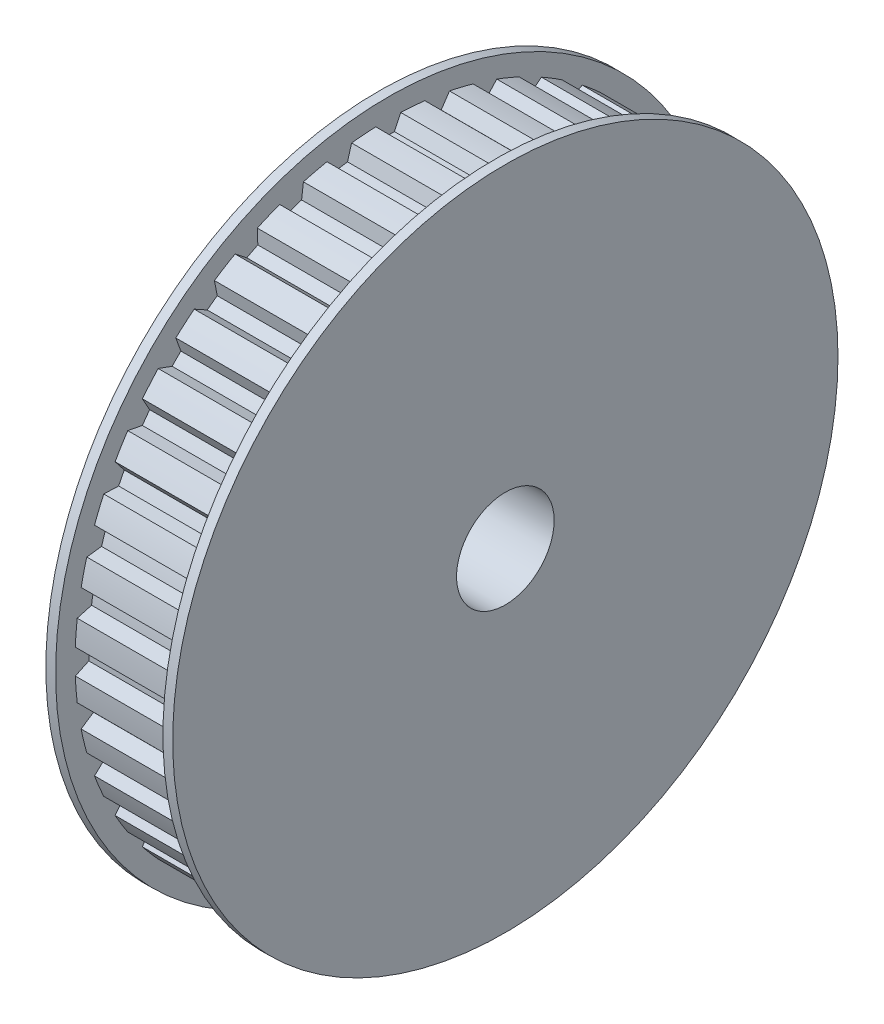
from build123d import *

# Parameters (mm, degrees)
SKETCH1_R           = 32.085
SKETCH1_R_2         = 5
BOSS_EXTRUDE1_DEPTH = 11
CUT_EXTRUDE1_DEPTH  = 47.68933979
SKETCH4_R           = 34.085
SKETCH4_R_2         = 5
BOSS_EXTRUDE2_DEPTH = 1
LPATTERN1_COUNT     = 2
LPATTERN1_PITCH     = 12


with BuildPart() as part:
    # Sketch1 → Boss-Extrude1 (new body)
    with BuildSketch(Plane(origin=(0, 0, 0), x_dir=(0, 0, -1), z_dir=(1, 0, 0))):
        Circle(SKETCH1_R)
        Circle(SKETCH1_R_2, mode=Mode.SUBTRACT)
    extrude(amount=BOSS_EXTRUDE1_DEPTH)

    # Sketch2 → Cut-Extrude1 (cut, through all)
    with BuildSketch(Plane.ZY):
        with BuildLine():
            Line((1.278957916, 32.059499242), (0.634954678, 30.678429842))
            ThreePointArc((0.634954678, 30.678429842), (0, 30.685), (-0.634954678, 30.678429842))
            Line((-0.634954678, 30.678429842), (-1.278957916, 32.059499242))
            ThreePointArc((-1.278957916, 32.059499242), (0, 32.085), (1.278957916, 32.059499242))
        make_face()
        with BuildLine():
            Line((6.278422435, 31.464720509), (5.426301093, 30.201398667))
            ThreePointArc((5.426301093, 30.201398667), (4.80019156, 30.307216731), (4.172026428, 30.400056258))
            Line((4.172026428, 30.400056258), (3.751998792, 31.864866704))
            ThreePointArc((3.751998792, 31.864866704), (5.019199811, 31.689980408), (6.278422435, 31.464720509))
        make_face()
        with BuildLine():
            Line((11.123291357, 30.095175932), (10.084033966, 28.980708825))
            ThreePointArc((10.084033966, 28.980708825), (9.482186472, 29.183169203), (8.876278398, 29.373132397))
            Line((8.876278398, 29.373132397), (8.690568837, 30.885615394))
            ThreePointArc((8.690568837, 30.885615394), (9.914810265, 30.514648325), (11.123291357, 30.095175932))
        make_face()
        with BuildLine():
            Line((15.694267929, 27.984588243), (14.493464456, 27.046417749))
            ThreePointArc((14.493464456, 27.046417749), (13.930698485, 27.340535195), (13.361966934, 27.622944532))
            Line((13.361966934, 27.622944532), (13.415148235, 29.14585773))
            ThreePointArc((13.415148235, 29.14585773), (14.566285184, 28.587944329), (15.694267929, 27.984588243))
        make_face()
        with BuildLine():
            Line((19.878799539, 25.184927117), (18.54601775, 24.446154107))
            ThreePointArc((18.54601775, 24.446154107), (18.036190467, 24.824686472), (17.518639499, 25.192588098))
            Line((17.518639499, 25.192588098), (17.809402161, 26.688432319))
            ThreePointArc((17.809402161, 26.688432319), (18.85908982, 25.957310265), (19.878799539, 25.184927117))
        make_face()
        with BuildLine():
            Line((23.573849131, 21.7651295), (22.141906536, 21.243945019))
            ThreePointArc((22.141906536, 21.243945019), (21.697571581, 21.697571581), (21.243945019, 22.141906536))
            Line((21.243945019, 22.141906536), (21.7651295, 23.573849131))
            ThreePointArc((21.7651295, 23.573849131), (22.687521074, 22.687521074), (23.573849131, 21.7651295))
        make_face()
        with BuildLine():
            Line((26.688432319, 17.809402161), (25.192588098, 17.518639499))
            ThreePointArc((25.192588098, 17.518639499), (24.824686472, 18.036190467), (24.446154107, 18.54601775))
            Line((24.446154107, 18.54601775), (25.184927117, 19.878799539))
            ThreePointArc((25.184927117, 19.878799539), (25.957310265, 18.85908982), (26.688432319, 17.809402161))
        make_face()
        with BuildLine():
            Line((29.14585773, 13.415148235), (27.622944532, 13.361966934))
            ThreePointArc((27.622944532, 13.361966934), (27.340535195, 13.930698485), (27.046417749, 14.493464456))
            Line((27.046417749, 14.493464456), (27.984588243, 15.694267929))
            ThreePointArc((27.984588243, 15.694267929), (28.587944329, 14.566285184), (29.14585773, 13.415148235))
        make_face()
        with BuildLine():
            Line((30.885615394, 8.690568837), (29.373132397, 8.876278398))
            ThreePointArc((29.373132397, 8.876278398), (29.183169203, 9.482186472), (28.980708825, 10.084033966))
            Line((28.980708825, 10.084033966), (30.095175932, 11.123291357))
            ThreePointArc((30.095175932, 11.123291357), (30.514648325, 9.914810265), (30.885615394, 8.690568837))
        make_face()
        with BuildLine():
            Line((31.864866704, 3.751998792), (30.400056258, 4.172026428))
            ThreePointArc((30.400056258, 4.172026428), (30.307216731, 4.80019156), (30.201398667, 5.426301093))
            Line((30.201398667, 5.426301093), (31.464720509, 6.278422435))
            ThreePointArc((31.464720509, 6.278422435), (31.689980408, 5.019199811), (31.864866704, 3.751998792))
        make_face()
        with BuildLine():
            Line((32.059499242, -1.278957916), (30.678429842, -0.634954678))
            ThreePointArc((30.678429842, -0.634954678), (30.685, 0), (30.678429842, 0.634954678))
            Line((30.678429842, 0.634954678), (32.059499242, 1.278957916))
            ThreePointArc((32.059499242, 1.278957916), (32.085, 0), (32.059499242, -1.278957916))
        make_face()
        with BuildLine():
            Line((31.464720509, -6.278422435), (30.201398667, -5.426301093))
            ThreePointArc((30.201398667, -5.426301093), (30.307216731, -4.80019156), (30.400056258, -4.172026428))
            Line((30.400056258, -4.172026428), (31.864866704, -3.751998792))
            ThreePointArc((31.864866704, -3.751998792), (31.689980408, -5.019199811), (31.464720509, -6.278422435))
        make_face()
        with BuildLine():
            Line((30.095175932, -11.123291357), (28.980708825, -10.084033966))
            ThreePointArc((28.980708825, -10.084033966), (29.183169203, -9.482186472), (29.373132397, -8.876278398))
            Line((29.373132397, -8.876278398), (30.885615394, -8.690568837))
            ThreePointArc((30.885615394, -8.690568837), (30.514648325, -9.914810265), (30.095175932, -11.123291357))
        make_face()
        with BuildLine():
            Line((27.984588243, -15.694267929), (27.046417749, -14.493464456))
            ThreePointArc((27.046417749, -14.493464456), (27.340535195, -13.930698485), (27.622944532, -13.361966934))
            Line((27.622944532, -13.361966934), (29.14585773, -13.415148235))
            ThreePointArc((29.14585773, -13.415148235), (28.587944329, -14.566285184), (27.984588243, -15.694267929))
        make_face()
        with BuildLine():
            Line((25.184927117, -19.878799539), (24.446154107, -18.54601775))
            ThreePointArc((24.446154107, -18.54601775), (24.824686472, -18.036190467), (25.192588098, -17.518639499))
            Line((25.192588098, -17.518639499), (26.688432319, -17.809402161))
            ThreePointArc((26.688432319, -17.809402161), (25.957310265, -18.85908982), (25.184927117, -19.878799539))
        make_face()
        with BuildLine():
            Line((21.7651295, -23.573849131), (21.243945019, -22.141906536))
            ThreePointArc((21.243945019, -22.141906536), (21.697571581, -21.697571581), (22.141906536, -21.243945019))
            Line((22.141906536, -21.243945019), (23.573849131, -21.7651295))
            ThreePointArc((23.573849131, -21.7651295), (22.687521074, -22.687521074), (21.7651295, -23.573849131))
        make_face()
        with BuildLine():
            Line((17.809402161, -26.688432319), (17.518639499, -25.192588098))
            ThreePointArc((17.518639499, -25.192588098), (18.036190467, -24.824686472), (18.54601775, -24.446154107))
            Line((18.54601775, -24.446154107), (19.878799539, -25.184927117))
            ThreePointArc((19.878799539, -25.184927117), (18.85908982, -25.957310265), (17.809402161, -26.688432319))
        make_face()
        with BuildLine():
            Line((13.415148235, -29.14585773), (13.361966934, -27.622944532))
            ThreePointArc((13.361966934, -27.622944532), (13.930698485, -27.340535195), (14.493464456, -27.046417749))
            Line((14.493464456, -27.046417749), (15.694267929, -27.984588243))
            ThreePointArc((15.694267929, -27.984588243), (14.566285184, -28.587944329), (13.415148235, -29.14585773))
        make_face()
        with BuildLine():
            Line((8.690568837, -30.885615394), (8.876278398, -29.373132397))
            ThreePointArc((8.876278398, -29.373132397), (9.482186472, -29.183169203), (10.084033966, -28.980708825))
            Line((10.084033966, -28.980708825), (11.123291357, -30.095175932))
            ThreePointArc((11.123291357, -30.095175932), (9.914810265, -30.514648325), (8.690568837, -30.885615394))
        make_face()
        with BuildLine():
            Line((3.751998792, -31.864866704), (4.172026428, -30.400056258))
            ThreePointArc((4.172026428, -30.400056258), (4.80019156, -30.307216731), (5.426301093, -30.201398667))
            Line((5.426301093, -30.201398667), (6.278422435, -31.464720509))
            ThreePointArc((6.278422435, -31.464720509), (5.019199811, -31.689980408), (3.751998792, -31.864866704))
        make_face()
        with BuildLine():
            Line((-1.278957916, -32.059499242), (-0.634954678, -30.678429842))
            ThreePointArc((-0.634954678, -30.678429842), (0, -30.685), (0.634954678, -30.678429842))
            Line((0.634954678, -30.678429842), (1.278957916, -32.059499242))
            ThreePointArc((1.278957916, -32.059499242), (0, -32.085), (-1.278957916, -32.059499242))
        make_face()
        with BuildLine():
            Line((-6.278422435, -31.464720509), (-5.426301093, -30.201398667))
            ThreePointArc((-5.426301093, -30.201398667), (-4.80019156, -30.307216731), (-4.172026428, -30.400056258))
            Line((-4.172026428, -30.400056258), (-3.751998792, -31.864866704))
            ThreePointArc((-3.751998792, -31.864866704), (-5.019199811, -31.689980408), (-6.278422435, -31.464720509))
        make_face()
        with BuildLine():
            Line((-11.123291357, -30.095175932), (-10.084033966, -28.980708825))
            ThreePointArc((-10.084033966, -28.980708825), (-9.482186472, -29.183169203), (-8.876278398, -29.373132397))
            Line((-8.876278398, -29.373132397), (-8.690568837, -30.885615394))
            ThreePointArc((-8.690568837, -30.885615394), (-9.914810265, -30.514648325), (-11.123291357, -30.095175932))
        make_face()
        with BuildLine():
            Line((-15.694267929, -27.984588243), (-14.493464456, -27.046417749))
            ThreePointArc((-14.493464456, -27.046417749), (-13.930698485, -27.340535195), (-13.361966934, -27.622944532))
            Line((-13.361966934, -27.622944532), (-13.415148235, -29.14585773))
            ThreePointArc((-13.415148235, -29.14585773), (-14.566285184, -28.587944329), (-15.694267929, -27.984588243))
        make_face()
        with BuildLine():
            Line((-19.878799539, -25.184927117), (-18.54601775, -24.446154107))
            ThreePointArc((-18.54601775, -24.446154107), (-18.036190467, -24.824686472), (-17.518639499, -25.192588098))
            Line((-17.518639499, -25.192588098), (-17.809402161, -26.688432319))
            ThreePointArc((-17.809402161, -26.688432319), (-18.85908982, -25.957310265), (-19.878799539, -25.184927117))
        make_face()
        with BuildLine():
            Line((-23.573849131, -21.7651295), (-22.141906536, -21.243945019))
            ThreePointArc((-22.141906536, -21.243945019), (-21.697571581, -21.697571581), (-21.243945019, -22.141906536))
            Line((-21.243945019, -22.141906536), (-21.7651295, -23.573849131))
            ThreePointArc((-21.7651295, -23.573849131), (-22.687521074, -22.687521074), (-23.573849131, -21.7651295))
        make_face()
        with BuildLine():
            Line((-26.688432319, -17.809402161), (-25.192588098, -17.518639499))
            ThreePointArc((-25.192588098, -17.518639499), (-24.824686472, -18.036190467), (-24.446154107, -18.54601775))
            Line((-24.446154107, -18.54601775), (-25.184927117, -19.878799539))
            ThreePointArc((-25.184927117, -19.878799539), (-25.957310265, -18.85908982), (-26.688432319, -17.809402161))
        make_face()
        with BuildLine():
            Line((-29.14585773, -13.415148235), (-27.622944532, -13.361966934))
            ThreePointArc((-27.622944532, -13.361966934), (-27.340535195, -13.930698485), (-27.046417749, -14.493464456))
            Line((-27.046417749, -14.493464456), (-27.984588243, -15.694267929))
            ThreePointArc((-27.984588243, -15.694267929), (-28.587944329, -14.566285184), (-29.14585773, -13.415148235))
        make_face()
        with BuildLine():
            Line((-30.885615394, -8.690568837), (-29.373132397, -8.876278398))
            ThreePointArc((-29.373132397, -8.876278398), (-29.183169203, -9.482186472), (-28.980708825, -10.084033966))
            Line((-28.980708825, -10.084033966), (-30.095175932, -11.123291357))
            ThreePointArc((-30.095175932, -11.123291357), (-30.514648325, -9.914810265), (-30.885615394, -8.690568837))
        make_face()
        with BuildLine():
            Line((-31.864866704, -3.751998792), (-30.400056258, -4.172026428))
            ThreePointArc((-30.400056258, -4.172026428), (-30.307216731, -4.80019156), (-30.201398667, -5.426301093))
            Line((-30.201398667, -5.426301093), (-31.464720509, -6.278422435))
            ThreePointArc((-31.464720509, -6.278422435), (-31.689980408, -5.019199811), (-31.864866704, -3.751998792))
        make_face()
        with BuildLine():
            Line((-32.059499242, 1.278957916), (-30.678429842, 0.634954678))
            ThreePointArc((-30.678429842, 0.634954678), (-30.685, 0), (-30.678429842, -0.634954678))
            Line((-30.678429842, -0.634954678), (-32.059499242, -1.278957916))
            ThreePointArc((-32.059499242, -1.278957916), (-32.085, 0), (-32.059499242, 1.278957916))
        make_face()
        with BuildLine():
            Line((-31.464720509, 6.278422435), (-30.201398667, 5.426301093))
            ThreePointArc((-30.201398667, 5.426301093), (-30.307216731, 4.80019156), (-30.400056258, 4.172026428))
            Line((-30.400056258, 4.172026428), (-31.864866704, 3.751998792))
            ThreePointArc((-31.864866704, 3.751998792), (-31.689980408, 5.019199811), (-31.464720509, 6.278422435))
        make_face()
        with BuildLine():
            Line((-30.095175932, 11.123291357), (-28.980708825, 10.084033966))
            ThreePointArc((-28.980708825, 10.084033966), (-29.183169203, 9.482186472), (-29.373132397, 8.876278398))
            Line((-29.373132397, 8.876278398), (-30.885615394, 8.690568837))
            ThreePointArc((-30.885615394, 8.690568837), (-30.514648325, 9.914810265), (-30.095175932, 11.123291357))
        make_face()
        with BuildLine():
            Line((-27.984588243, 15.694267929), (-27.046417749, 14.493464456))
            ThreePointArc((-27.046417749, 14.493464456), (-27.340535195, 13.930698485), (-27.622944532, 13.361966934))
            Line((-27.622944532, 13.361966934), (-29.14585773, 13.415148235))
            ThreePointArc((-29.14585773, 13.415148235), (-28.587944329, 14.566285184), (-27.984588243, 15.694267929))
        make_face()
        with BuildLine():
            Line((-25.184927117, 19.878799539), (-24.446154107, 18.54601775))
            ThreePointArc((-24.446154107, 18.54601775), (-24.824686472, 18.036190467), (-25.192588098, 17.518639499))
            Line((-25.192588098, 17.518639499), (-26.688432319, 17.809402161))
            ThreePointArc((-26.688432319, 17.809402161), (-25.957310265, 18.85908982), (-25.184927117, 19.878799539))
        make_face()
        with BuildLine():
            Line((-21.7651295, 23.573849131), (-21.243945019, 22.141906536))
            ThreePointArc((-21.243945019, 22.141906536), (-21.697571581, 21.697571581), (-22.141906536, 21.243945019))
            Line((-22.141906536, 21.243945019), (-23.573849131, 21.7651295))
            ThreePointArc((-23.573849131, 21.7651295), (-22.687521074, 22.687521074), (-21.7651295, 23.573849131))
        make_face()
        with BuildLine():
            Line((-17.809402161, 26.688432319), (-17.518639499, 25.192588098))
            ThreePointArc((-17.518639499, 25.192588098), (-18.036190467, 24.824686472), (-18.54601775, 24.446154107))
            Line((-18.54601775, 24.446154107), (-19.878799539, 25.184927117))
            ThreePointArc((-19.878799539, 25.184927117), (-18.85908982, 25.957310265), (-17.809402161, 26.688432319))
        make_face()
        with BuildLine():
            Line((-13.415148235, 29.14585773), (-13.361966934, 27.622944532))
            ThreePointArc((-13.361966934, 27.622944532), (-13.930698485, 27.340535195), (-14.493464456, 27.046417749))
            Line((-14.493464456, 27.046417749), (-15.694267929, 27.984588243))
            ThreePointArc((-15.694267929, 27.984588243), (-14.566285184, 28.587944329), (-13.415148235, 29.14585773))
        make_face()
        with BuildLine():
            Line((-8.690568837, 30.885615394), (-8.876278398, 29.373132397))
            ThreePointArc((-8.876278398, 29.373132397), (-9.482186472, 29.183169203), (-10.084033966, 28.980708825))
            Line((-10.084033966, 28.980708825), (-11.123291357, 30.095175932))
            ThreePointArc((-11.123291357, 30.095175932), (-9.914810265, 30.514648325), (-8.690568837, 30.885615394))
        make_face()
        with BuildLine():
            Line((-3.751998792, 31.864866704), (-4.172026428, 30.400056258))
            ThreePointArc((-4.172026428, 30.400056258), (-4.80019156, 30.307216731), (-5.426301093, 30.201398667))
            Line((-5.426301093, 30.201398667), (-6.278422435, 31.464720509))
            ThreePointArc((-6.278422435, 31.464720509), (-5.019199811, 31.689980408), (-3.751998792, 31.864866704))
        make_face()
    extrude(amount=-CUT_EXTRUDE1_DEPTH, mode=Mode.SUBTRACT)

    # Sketch4 → Boss-Extrude2 (add)
    with BuildSketch(Plane(origin=(11, 0, 0), x_dir=(0, 0, -1), z_dir=(1, 0, 0))):
        Circle(SKETCH4_R)
        Circle(SKETCH4_R_2, mode=Mode.SUBTRACT)
    boss_extrude2 = extrude(amount=BOSS_EXTRUDE2_DEPTH)

    # LPattern1: Boss-Extrude2 ×2
    with Locations(*[(-i * LPATTERN1_PITCH, 0, 0) for i in range(1, LPATTERN1_COUNT)]):
        add(boss_extrude2)


solid = part.part
